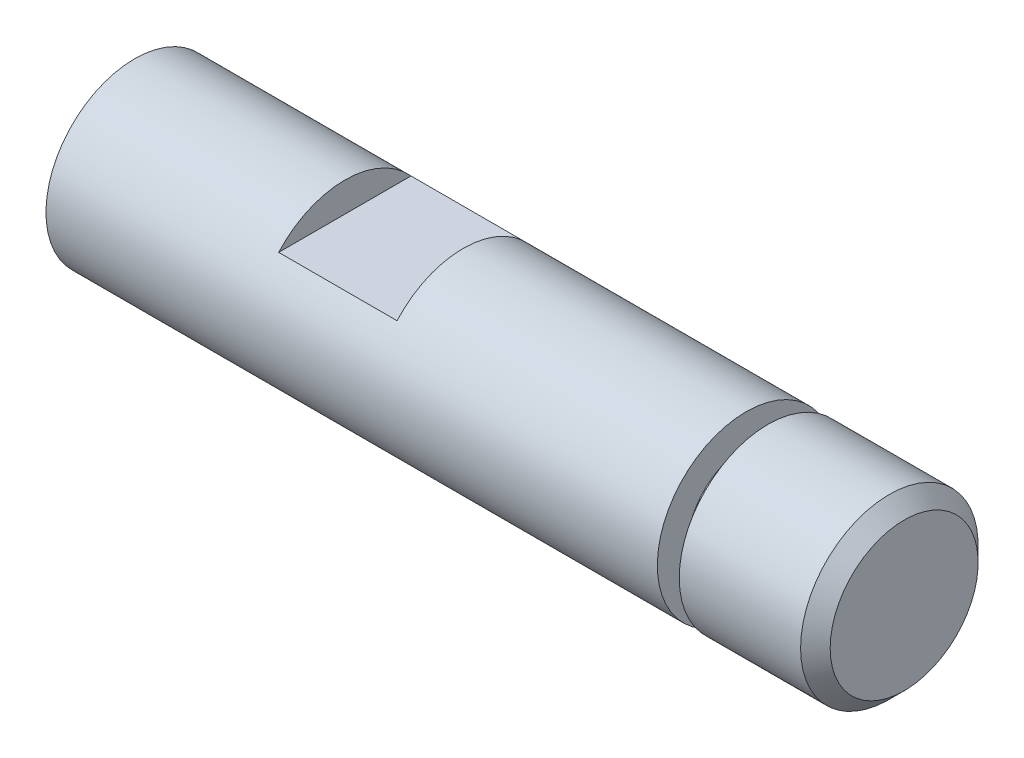
from build123d import *

# Parameters (mm, degrees)
ESQUISSE1_W                  = 52
ESQUISSE1_H                  = 3
CHANFREIN1_SIZE              = 0.5
ENL_V_MAT_EXTRU_1_DEPTH      = 27.343879745
ENL_V_MAT_EXTRU_1_DEPTH_BACK = 27.343879745
ESQUISSE2_W                  = 4
ESQUISSE2_H                  = 2
ESQUISSE3_W                  = 0.74
ESQUISSE3_H                  = 1
BOSS_EXTRU_1_START           = 15
ESQUISSE4_R                  = 3
BOSS_EXTRU_1_DEPTH           = 15
ENL_V_MAT_EXTRU_2_DEPTH      = 42.218927691
ENL_V_MAT_EXTRU_2_DEPTH_BACK = 42.218927691
ESQUISSE5_W                  = 12
ESQUISSE5_H                  = 1
ENL_V_MAT_EXTRU_3_DEPTH      = 42.218927691
ENL_V_MAT_EXTRU_3_DEPTH_BACK = 42.218927691
ESQUISSE6_W                  = 50.211323454
ESQUISSE6_H                  = 20.21753951


with BuildPart() as part:
    # Esquisse1 → Révolution1 (revolve)
    with BuildSketch(Plane.XY, mode=Mode.PRIVATE) as r_volution1_sk:
        with Locations((0, 1.5)):
            Rectangle(ESQUISSE1_W, ESQUISSE1_H)
    revolve(r_volution1_sk.sketch.rotate(Axis((0, 0, 0), (1, 0, 0)), 90), axis=Axis((0, 0, 0), (1, 0, 0)))

    # Chanfrein1
    chanfrein1_edges = [part.edges().sort_by_distance(p)[0] for p in [
        (26, 0, -3),
    ]]
    chamfer(chanfrein1_edges, length=CHANFREIN1_SIZE)

    # Esquisse2 → Enlèv. mat.-Extru.1 (cut, two sides: drawn at the far end of the back side and taken through both)
    with BuildSketch(Plane.XY.offset(-ENL_V_MAT_EXTRU_1_DEPTH_BACK)):
        with Locations((9.1, 3)):
            Rectangle(ESQUISSE2_W, ESQUISSE2_H)
    extrude(amount=ENL_V_MAT_EXTRU_1_DEPTH + ENL_V_MAT_EXTRU_1_DEPTH_BACK, mode=Mode.SUBTRACT)

    # Esquisse3 → Enlèvement de matière-Révolution1 (revolve, cut)
    with BuildSketch(Plane.XY):
        with Locations((-21.03, 2.5)):
            Rectangle(ESQUISSE3_W, ESQUISSE3_H)
        with Locations((21.03, 2.5)):
            Rectangle(ESQUISSE3_W, ESQUISSE3_H)
    revolve(axis=Axis((0, 0, 0), (-1, 0, 0)), mode=Mode.SUBTRACT)

    # Esquisse4 → Boss.-Extru.1 (add)
    with BuildSketch(Plane.ZY.offset(26).offset(BOSS_EXTRU_1_START)):
        with Locations(Location((0, 0, 0), (0, 0, 90))):
            Circle(ESQUISSE4_R)
    extrude(amount=-BOSS_EXTRU_1_DEPTH)

    # Esquisse5 → Enlèv. mat.-Extru.2 (cut, two sides: drawn at the far end of the back side and taken through both)
    with BuildSketch(Plane.XY.offset(-ENL_V_MAT_EXTRU_2_DEPTH_BACK)):
        with Locations((-35, 2.5)):
            Rectangle(ESQUISSE5_W, ESQUISSE5_H)
    extrude(amount=ENL_V_MAT_EXTRU_2_DEPTH + ENL_V_MAT_EXTRU_2_DEPTH_BACK, mode=Mode.SUBTRACT)

    # Esquisse6 → Enlèv. mat.-Extru.3 (cut, two sides: drawn at the far end of the back side and taken through both)
    with BuildSketch(Plane.XY.offset(-ENL_V_MAT_EXTRU_3_DEPTH_BACK)):
        with Locations((-25.105661727, 1.097333559)):
            Rectangle(ESQUISSE6_W, ESQUISSE6_H)
    extrude(amount=ENL_V_MAT_EXTRU_3_DEPTH + ENL_V_MAT_EXTRU_3_DEPTH_BACK, mode=Mode.SUBTRACT)


solid = part.part
